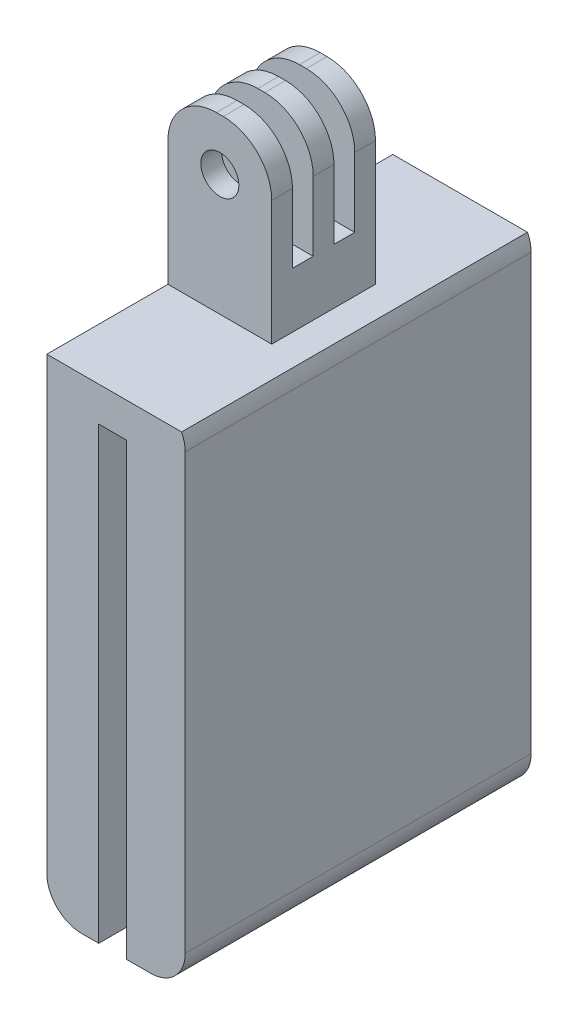
from build123d import *

# Parameters (mm, degrees)
SKETCH1_W           = 4
SKETCH1_H           = 60
BOSS_EXTRUDE1_DEPTH = 50
CUT_EXTRUDE3_REACH  = 81.53
SKETCH2_W           = 17.5
SKETCH2_H           = 25
SKETCH2_W_2         = 3
SKETCH2_H_2         = 17
SKETCH3_R           = 2.75
CUT_EXTRUDE4_DEPTH  = 70.865943062
SKETCH5_W           = 4
SKETCH5_H           = 5
CUT_EXTRUDE5_DEPTH  = 80.529868603
FILLET1_R           = 7


with BuildPart() as part:
    # Sketch1 → Boss-Extrude1 (new body)
    with BuildSketch(Plane.XY):
        with BuildLine():
            Line((4.472135955, 35), (0, 35))
            Line((0, 35), (0, 60))
            Line((0, 60), (-15, 60))
            Line((-15, 60), (-15, 35))
            Line((-15, 35), (-15, -30))
            ThreePointArc((-15, -30), (-13.535533906, -33.535533906), (-10, -35))
            Line((-10, -35), (0, -35))
            ThreePointArc((0, -35), (3.535533906, -33.535533906), (5, -30))
            Line((5, -30), (5, 32.763932023))
            ThreePointArc((5, 32.763932023), (4.866244947, 33.912696625), (4.472135955, 35))
        make_face()
        with Locations((-5.5, 0)):
            Rectangle(SKETCH1_W, SKETCH1_H, mode=Mode.SUBTRACT)
    extrude(amount=BOSS_EXTRUDE1_DEPTH)

    # Sketch2 → Cut-Extrude3 (cut, up to next)
    with BuildSketch(Plane(origin=(0, 0, 0), x_dir=(0, 0, -1), z_dir=(1, 0, 0)), mode=Mode.PRIVATE) as cut_extrude3_sk1:
        with Locations((-8.75, 47.5)):
            Rectangle(SKETCH2_W, SKETCH2_H)
    cut_extrude3_tool1 = extrude(cut_extrude3_sk1.sketch, amount=-CUT_EXTRUDE3_REACH, mode=Mode.PRIVATE) & part.part
    # Sketch2 → Cut-Extrude3 (cut, up to next)
    with BuildSketch(Plane(origin=(0, 0, 0), x_dir=(0, 0, -1), z_dir=(1, 0, 0)), mode=Mode.PRIVATE) as cut_extrude3_sk2:
        with Locations((-41.25, 47.5)):
            Rectangle(SKETCH2_W, SKETCH2_H)
    cut_extrude3_tool2 = extrude(cut_extrude3_sk2.sketch, amount=-CUT_EXTRUDE3_REACH, mode=Mode.PRIVATE) & part.part
    # Sketch2 → Cut-Extrude3 (cut, up to next)
    with BuildSketch(Plane(origin=(0, 0, 0), x_dir=(0, 0, -1), z_dir=(1, 0, 0)), mode=Mode.PRIVATE) as cut_extrude3_sk3:
        with Locations((-28, 51.5)):
            Rectangle(SKETCH2_W_2, SKETCH2_H_2)
    cut_extrude3_tool3 = extrude(cut_extrude3_sk3.sketch, amount=-CUT_EXTRUDE3_REACH, mode=Mode.PRIVATE) & part.part
    # Sketch2 → Cut-Extrude3 (cut, up to next)
    with BuildSketch(Plane(origin=(0, 0, 0), x_dir=(0, 0, -1), z_dir=(1, 0, 0)), mode=Mode.PRIVATE) as cut_extrude3_sk4:
        with Locations((-22, 51.5)):
            Rectangle(SKETCH2_W_2, SKETCH2_H_2)
    cut_extrude3_tool4 = extrude(cut_extrude3_sk4.sketch, amount=-CUT_EXTRUDE3_REACH, mode=Mode.PRIVATE) & part.part
    add(cut_extrude3_tool1.solids().sort_by_distance((0, 47.5, 8.75))[0], mode=Mode.SUBTRACT)
    add(cut_extrude3_tool2.solids().sort_by_distance((0, 47.5, 41.25))[0], mode=Mode.SUBTRACT)
    add(cut_extrude3_tool3.solids().sort_by_distance((0, 51.5, 28))[0], mode=Mode.SUBTRACT)
    add(cut_extrude3_tool4.solids().sort_by_distance((0, 51.5, 22))[0], mode=Mode.SUBTRACT)

    # Sketch3 → Cut-Extrude4 (cut, through all)
    with BuildSketch(Plane.XY.offset(32.5)):
        with Locations((-7.5, 52.5)):
            Circle(SKETCH3_R)
    extrude(amount=-CUT_EXTRUDE4_DEPTH, mode=Mode.SUBTRACT)

    # Sketch5 → Cut-Extrude5 (cut, through all)
    with BuildSketch(Plane.XY.offset(50)):
        with Locations((-5.5, -32.5)):
            Rectangle(SKETCH5_W, SKETCH5_H)
    extrude(amount=-CUT_EXTRUDE5_DEPTH, mode=Mode.SUBTRACT)

    # Fillet1
    fillet1_edges = [part.edges().sort_by_distance(p)[0] for p in [
        (-15, 60, 31),
        (-15, 60, 25),
        (-15, 60, 19),
        (0, 60, 31),
        (0, 60, 25),
        (0, 60, 19),
    ]]
    fillet(fillet1_edges, radius=FILLET1_R)


solid = part.part
